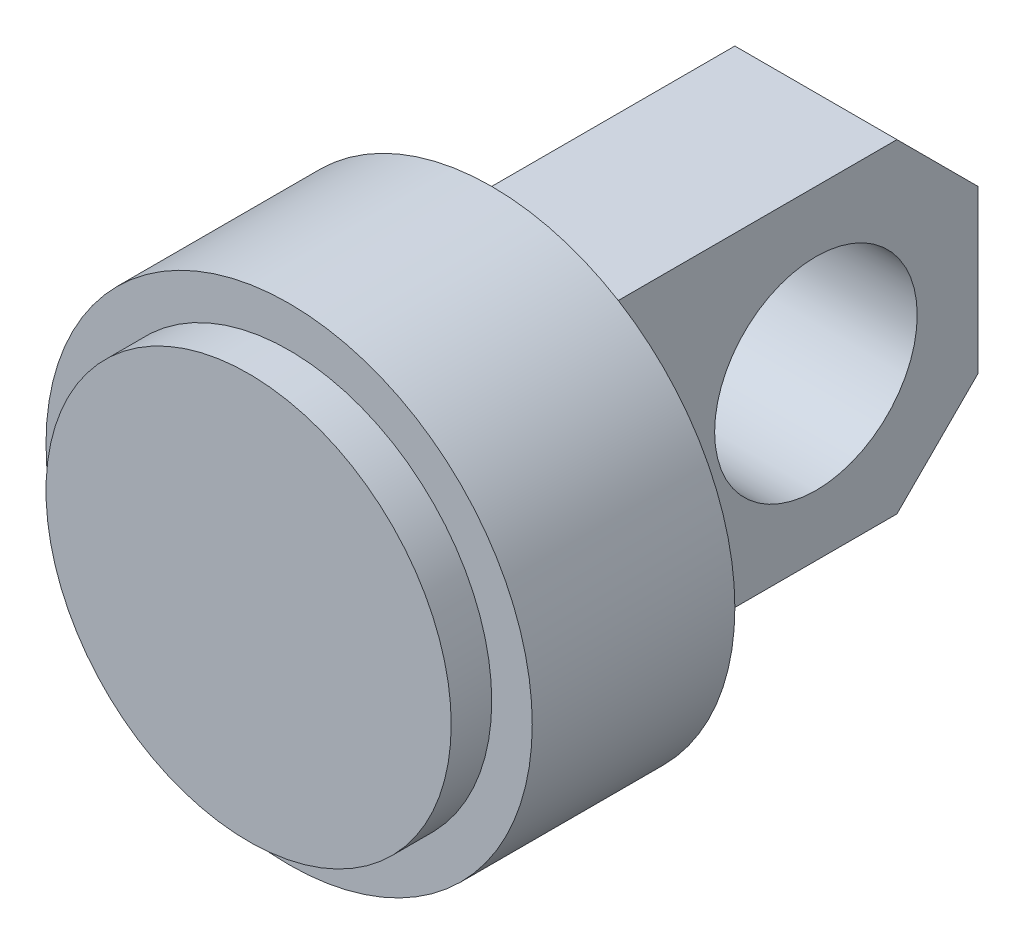
from build123d import *

# Parameters (mm, degrees)
SKETCH1_R           = 25
BOSS_EXTRUDE1_DEPTH = 5
SKETCH2_R           = 30
BOSS_EXTRUDE2_DEPTH = 25
SKETCH3_W           = 20
SKETCH3_H           = 40
BOSS_EXTRUDE3_DEPTH = 50
CHAMFER1_SIZE       = 10
SKETCH5_R           = 12.5
CUT_EXTRUDE1_DEPTH  = 91.138781887


with BuildPart() as part:
    # Sketch1 → Boss-Extrude1 (new body)
    with BuildSketch(Plane.XY):
        Circle(SKETCH1_R)
    extrude(amount=BOSS_EXTRUDE1_DEPTH)

    # Sketch2 → Boss-Extrude2 (add)
    with BuildSketch(Plane(origin=(0, 0, 0), x_dir=(-1, 0, 0), z_dir=(0, 0, -1))):
        Circle(SKETCH2_R)
    extrude(amount=BOSS_EXTRUDE2_DEPTH)

    # Sketch3 → Boss-Extrude3 (add)
    with BuildSketch(Plane(origin=(0, 0, -25), x_dir=(-1, 0, 0), z_dir=(0, 0, -1))):
        Rectangle(SKETCH3_W, SKETCH3_H)
    extrude(amount=BOSS_EXTRUDE3_DEPTH)

    # Chamfer1
    chamfer1_edges = [part.edges().sort_by_distance(p)[0] for p in [
        (0, 20, -75),
        (0, -20, -75),
    ]]
    chamfer(chamfer1_edges, length=CHAMFER1_SIZE)

    # Sketch5 → Cut-Extrude1 (cut, through all)
    with BuildSketch(Plane.ZY.offset(10)):
        with Locations((-55, 0)):
            Circle(SKETCH5_R)
    extrude(amount=-CUT_EXTRUDE1_DEPTH, mode=Mode.SUBTRACT)


solid = part.part
